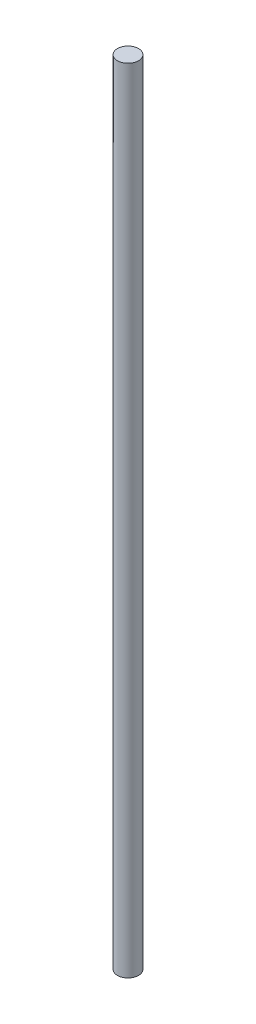
from build123d import *

# Parameters (mm, degrees)
SKETCH1_R           = 10
BOSS_EXTRUDE1_DEPTH = 375


with BuildPart() as part:
    # Sketch1 → Boss-Extrude1 (new, symmetric)
    with BuildSketch(Plane(origin=(0, 0, 0), x_dir=(1, 0, 0), z_dir=(0, 1, 0))):
        with Locations(Location((0, 0, 0), (0, 0, 270))):
            Circle(SKETCH1_R)
    extrude(amount=BOSS_EXTRUDE1_DEPTH, both=True)


solid = part.part
